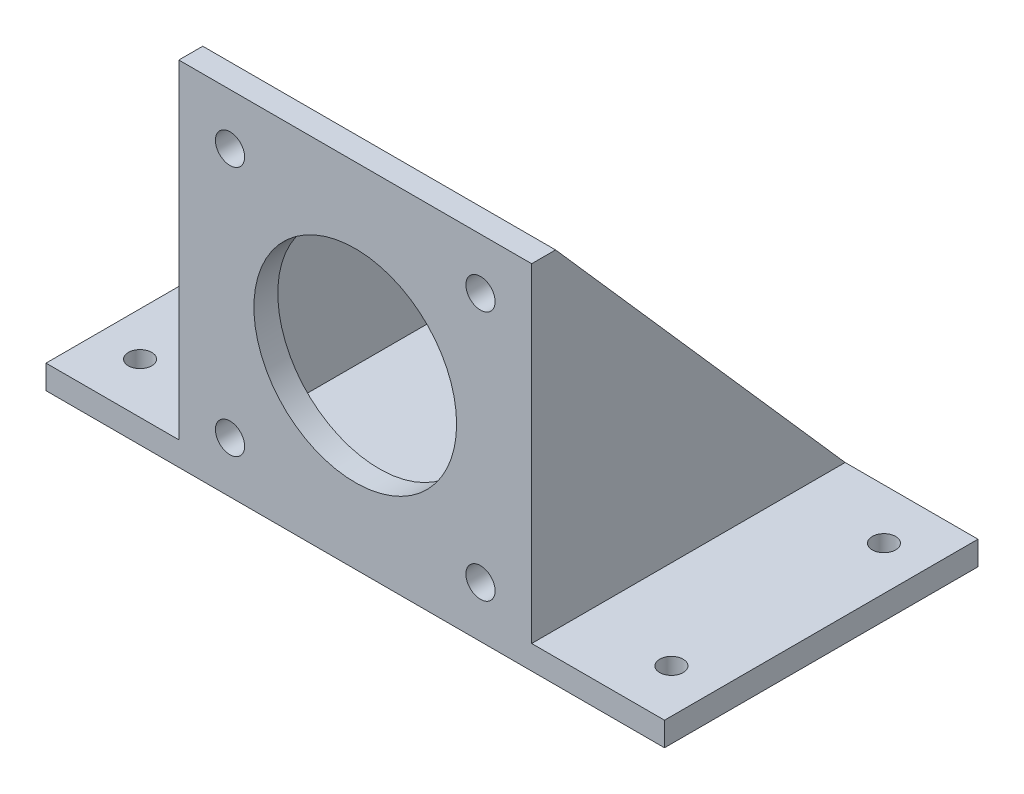
from build123d import *

# Parameters (mm, degrees)
SKETCH1_W           = 66.4
SKETCH1_H           = 66.4
BOSS_EXTRUDE1_DEPTH = 59
SKETCH2_R           = 19.075
SKETCH2_R_2         = 2.75
CUT_EXTRUDE1_DEPTH  = 111.900495941
SKETCH3_W           = 57.4
SKETCH3_H           = 54.5
CUT_EXTRUDE2_DEPTH  = 61.9
CUT_EXTRUDE3_DEPTH  = 111.900495941
SKETCH5_W           = 116.4
SKETCH5_H           = 59
BOSS_EXTRUDE2_DEPTH = 4.5
SKETCH6_R           = 2.2
CUT_EXTRUDE4_DEPTH  = 126.166169551


with BuildPart() as part:
    # Sketch1 → Boss-Extrude1 (new body)
    with BuildSketch(Plane.XY):
        with Locations((33.2, 33.2)):
            Rectangle(SKETCH1_W, SKETCH1_H)
    extrude(amount=BOSS_EXTRUDE1_DEPTH)

    # Sketch2 → Cut-Extrude1 (cut, through all)
    with BuildSketch(Plane.XY.offset(59)):
        with Locations((33.2, 33.2)):
            Circle(SKETCH2_R)
        with Locations((9.63, 56.77)):
            Circle(SKETCH2_R_2)
        with Locations((56.77, 56.77)):
            Circle(SKETCH2_R_2)
        with Locations((56.77, 9.63)):
            Circle(SKETCH2_R_2)
        with Locations((9.63, 9.63)):
            Circle(SKETCH2_R_2)
    extrude(amount=-CUT_EXTRUDE1_DEPTH, mode=Mode.SUBTRACT)

    # Sketch3 → Cut-Extrude2 (cut)
    with BuildSketch(Plane(origin=(0, 66.4, 0), x_dir=(1, 0, 0), z_dir=(0, 1, 0))):
        with Locations((33.2, -27.25)):
            Rectangle(SKETCH3_W, SKETCH3_H)
    extrude(amount=-CUT_EXTRUDE2_DEPTH, mode=Mode.SUBTRACT)

    # Sketch4 → Cut-Extrude3 (cut, through all)
    with BuildSketch(Plane(origin=(66.4, 0, 0), x_dir=(0, 0, -1), z_dir=(1, 0, 0))):
        Polygon((-54.5, 66.4), (0, 66.4), (0, 4.5), align=None)
    extrude(amount=-CUT_EXTRUDE3_DEPTH, mode=Mode.SUBTRACT)

    # Sketch5 → Boss-Extrude2 (add)
    with BuildSketch(Plane.XZ):
        with Locations((33.2, 29.5)):
            Rectangle(SKETCH5_W, SKETCH5_H)
    extrude(amount=-BOSS_EXTRUDE2_DEPTH)

    # Sketch6 → Cut-Extrude4 (cut, through all)
    with BuildSketch(Plane(origin=(0, 4.5, 0), x_dir=(1, 0, 0), z_dir=(0, 1, 0))):
        with Locations(Location((-16.8, -9.5, 0), (0, 0, 270))):
            Circle(SKETCH6_R)
        with Locations(Location((-16.8, -49.5, 0), (0, 0, 270))):
            Circle(SKETCH6_R)
        with Locations(Location((83.2, -49.5, 0), (0, 0, 270))):
            Circle(SKETCH6_R)
        with Locations(Location((83.2, -9.5, 0), (0, 0, 270))):
            Circle(SKETCH6_R)
    extrude(amount=-CUT_EXTRUDE4_DEPTH, mode=Mode.SUBTRACT)


solid = part.part
